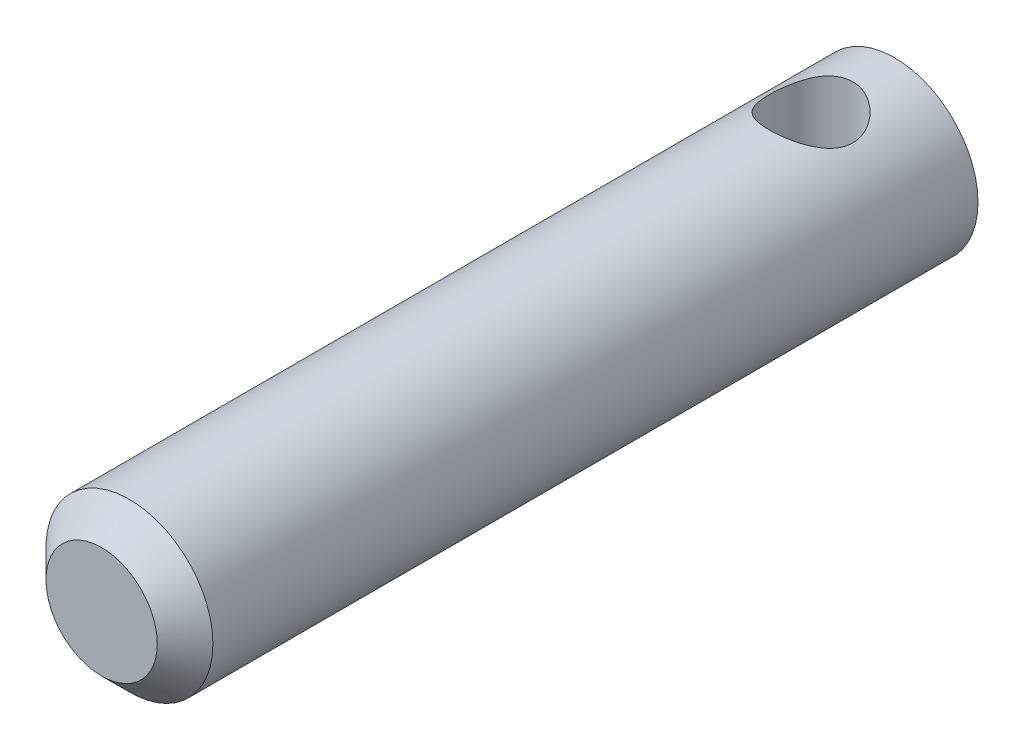
from build123d import *

# Parameters (mm, degrees)
ESQUISSE1_R                  = 3
BOSS_EXTRU_1_DEPTH           = 28.5
ENL_V_MAT_EXTRU_1_DEPTH      = 29.814059068
ENL_V_MAT_EXTRU_1_DEPTH_BACK = 29.814059068
ESQUISSE2_R                  = 1.5
CHANFREIN1_SIZE              = 1


with BuildPart() as part:
    # Esquisse1 → Boss.-Extru.1 (new body)
    with BuildSketch(Plane.XY):
        with Locations(Location((0, 0, 0), (0, 0, 180))):
            Circle(ESQUISSE1_R)
    extrude(amount=BOSS_EXTRU_1_DEPTH)

    # Esquisse2 → Enlèv. mat.-Extru.1 (cut, two sides: drawn at the far end of the back side and taken through both)
    with BuildSketch(Plane(origin=(0, 0, 0), x_dir=(1, 0, 0), z_dir=(0, 1, 0)).offset(-ENL_V_MAT_EXTRU_1_DEPTH_BACK)):
        with Locations(Location((0, -3, 0), (0, 0, 270))):
            Circle(ESQUISSE2_R)
    extrude(amount=ENL_V_MAT_EXTRU_1_DEPTH + ENL_V_MAT_EXTRU_1_DEPTH_BACK, mode=Mode.SUBTRACT)

    # Chanfrein1
    chanfrein1_edges = [part.edges().sort_by_distance(p)[0] for p in [
        (3, 0, 28.5),
    ]]
    chamfer(chanfrein1_edges, length=CHANFREIN1_SIZE)


solid = part.part
